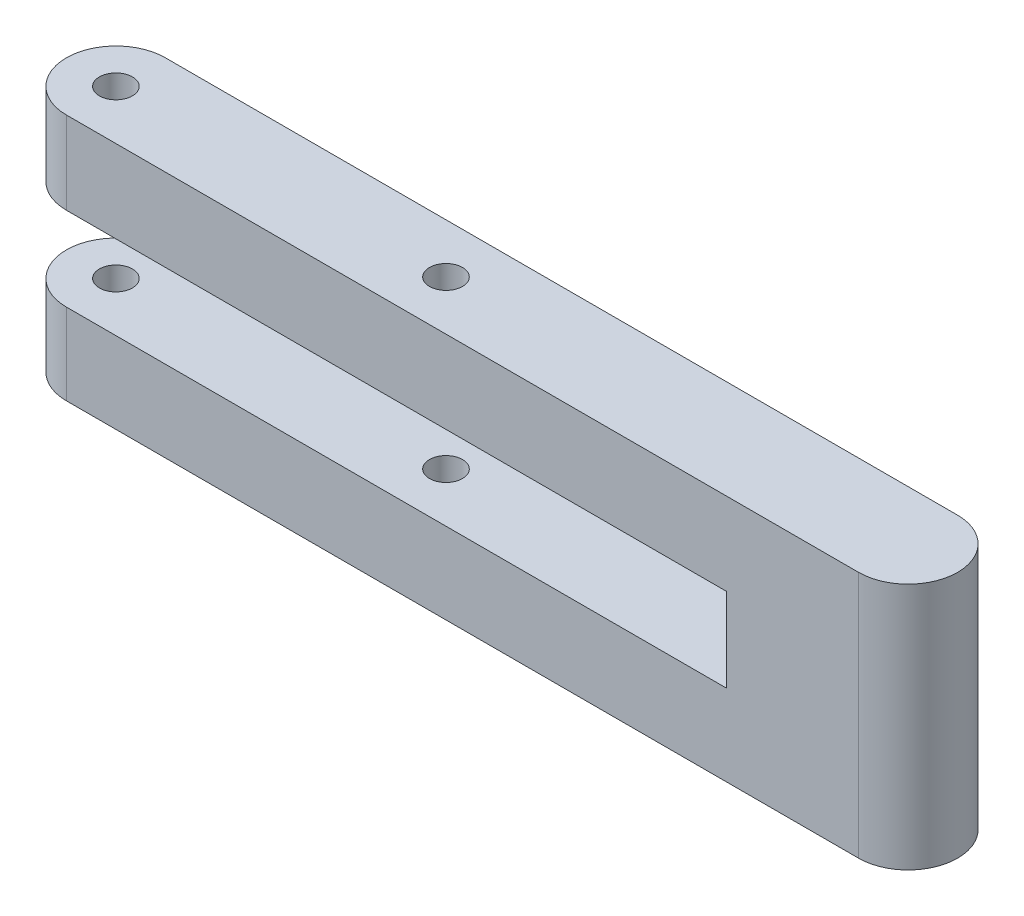
from build123d import *

# Parameters (mm, degrees)
BOSS_EXTRUDE1_DEPTH     = 38.1
SKETCH4_R               = 2.54
CUT_EXTRUDE3_DEPTH      = 88.804680969
CUT_EXTRUDE4_DEPTH      = 6.35
CUT_EXTRUDE4_DEPTH_BACK = 6.550000108


with BuildPart() as part:
    # Sketch3 → Boss-Extrude1 (new body)
    with BuildSketch(Plane(origin=(0, 0, 0), x_dir=(1, 0, 0), z_dir=(0, 1, 0))):
        with BuildLine():
            Line((-50.8, 7.62), (71.12, 7.62))
            ThreePointArc((71.12, 7.62), (78.74, 0), (71.12, -7.62))
            Line((71.12, -7.62), (-50.8, -7.62))
            ThreePointArc((-50.8, -7.62), (-58.42, 0), (-50.8, 7.62))
        make_face()
    extrude(amount=BOSS_EXTRUDE1_DEPTH)

    # Sketch4 → Cut-Extrude3 (cut, through all)
    with BuildSketch(Plane(origin=(0, 38.1, 0), x_dir=(1, 0, 0), z_dir=(0, 1, 0))):
        with Locations(Location((-50.8, 0, 0), (0, 0, 270))):
            Circle(SKETCH4_R)
        with Locations(Location((0, 0, 0), (0, 0, 270))):
            Circle(SKETCH4_R)
    extrude(amount=-CUT_EXTRUDE3_DEPTH, mode=Mode.SUBTRACT)

    # Sketch5 → Cut-Extrude4 (cut, two sides: drawn at the far end of the back side and taken through both)
    with BuildSketch(Plane(origin=(0, 19.05, 0), x_dir=(1, 0, 0), z_dir=(0, 1, 0)).offset(-CUT_EXTRUDE4_DEPTH_BACK)):
        with BuildLine():
            Line((25.4, 7.62), (-50.8, 7.62))
            ThreePointArc((-50.8, 7.62), (-58.42, 0), (-50.8, -7.62))
            Line((-50.8, -7.62), (0, -7.62))
            Line((0, -7.62), (50.8, -7.62))
            Line((50.8, -7.62), (50.8, 7.62))
            Line((50.8, 7.62), (25.4, 7.62))
        make_face()
    extrude(amount=CUT_EXTRUDE4_DEPTH + CUT_EXTRUDE4_DEPTH_BACK, mode=Mode.SUBTRACT)


solid = part.part
